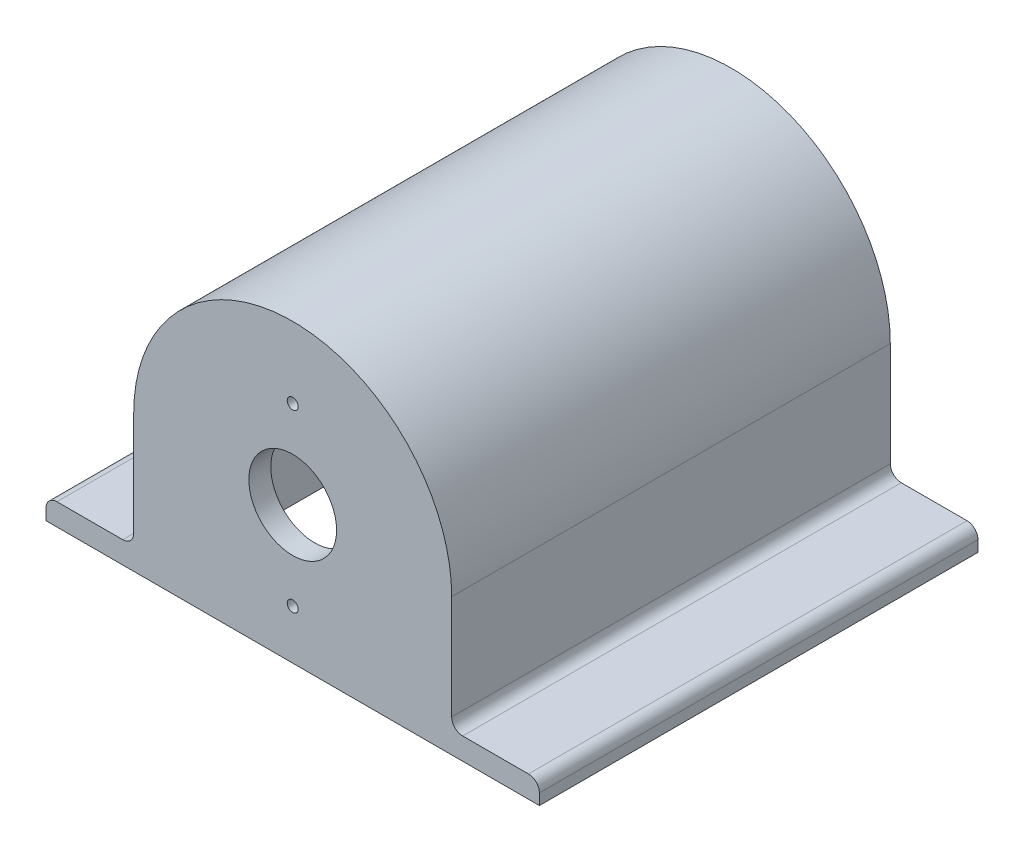
from build123d import *

# Parameters (mm, degrees)
BOSS_EXTRU_1_DEPTH      = 40
ESQUISSE2_W             = 2
ESQUISSE2_H             = 40
BOSS_EXTRU_2_DEPTH      = 12.5
ESQUISSE3_W             = 10
ESQUISSE3_H             = 40
BOSS_EXTRU_3_DEPTH      = 2
BOSS_EXTRU_4_START      = -2
ESQUISSE4_R             = 4
BOSS_EXTRU_4_DEPTH      = 2
CONG_1_R                = 1
ESQUISSE5_R             = 0.5
ENL_V_MAT_EXTRU_1_DEPTH = 49.130032204


with BuildPart() as part:
    # Esquisse1 → Boss.-Extru.1 (new body)
    with BuildSketch(Plane.XY):
        with BuildLine():
            ThreePointArc((-12.5, 0), (0, 12.5), (12.5, 0))
            Line((12.5, 0), (14.5, 0))
            ThreePointArc((14.5, 0), (0, 14.5), (-14.5, 0))
            Line((-14.5, 0), (-12.5, 0))
        make_face()
    extrude(amount=BOSS_EXTRU_1_DEPTH)

    # Esquisse2 → Boss.-Extru.2 (add)
    with BuildSketch(Plane.XZ):
        with Locations((-13.5, 20)):
            Rectangle(ESQUISSE2_W, ESQUISSE2_H)
        with Locations((13.5, 20)):
            Rectangle(ESQUISSE2_W, ESQUISSE2_H)
    extrude(amount=BOSS_EXTRU_2_DEPTH)

    # Esquisse3 → Boss.-Extru.3 (add)
    with BuildSketch(Plane.XZ.offset(12.5)):
        with Locations((-17.5, 20)):
            Rectangle(ESQUISSE3_W, ESQUISSE3_H)
        with Locations((17.5, 20)):
            Rectangle(ESQUISSE3_W, ESQUISSE3_H)
    extrude(amount=-BOSS_EXTRU_3_DEPTH)

    # Esquisse4 → Boss.-Extru.4 (add)
    with BuildSketch(Plane.XY.offset(40).offset(BOSS_EXTRU_4_START)):
        with BuildLine():
            Line((-12.5, 0), (-12.5, -12.5))
            Line((-12.5, -12.5), (12.5, -12.5))
            Line((12.5, -12.5), (12.5, 0))
            ThreePointArc((12.5, 0), (0, 12.5), (-12.5, 0))
        make_face()
        Circle(ESQUISSE4_R, mode=Mode.SUBTRACT)
    extrude(amount=BOSS_EXTRU_4_DEPTH)

    # Congé1
    cong_1_edges = [part.edges().sort_by_distance(p)[0] for p in [
        (-22.5, -10.5, 20),
        (-14.5, -10.5, 20),
        (14.5, -10.5, 20),
        (22.5, -10.5, 20),
    ]]
    fillet(cong_1_edges, radius=CONG_1_R)

    # Esquisse5 → Enlèv. mat.-Extru.1 (cut, through all)
    with BuildSketch(Plane.XY.offset(40)):
        with Locations((0, -8)):
            Circle(ESQUISSE5_R)
        with Locations((0, 8)):
            Circle(ESQUISSE5_R)
    extrude(amount=-ENL_V_MAT_EXTRU_1_DEPTH, mode=Mode.SUBTRACT)


solid = part.part
